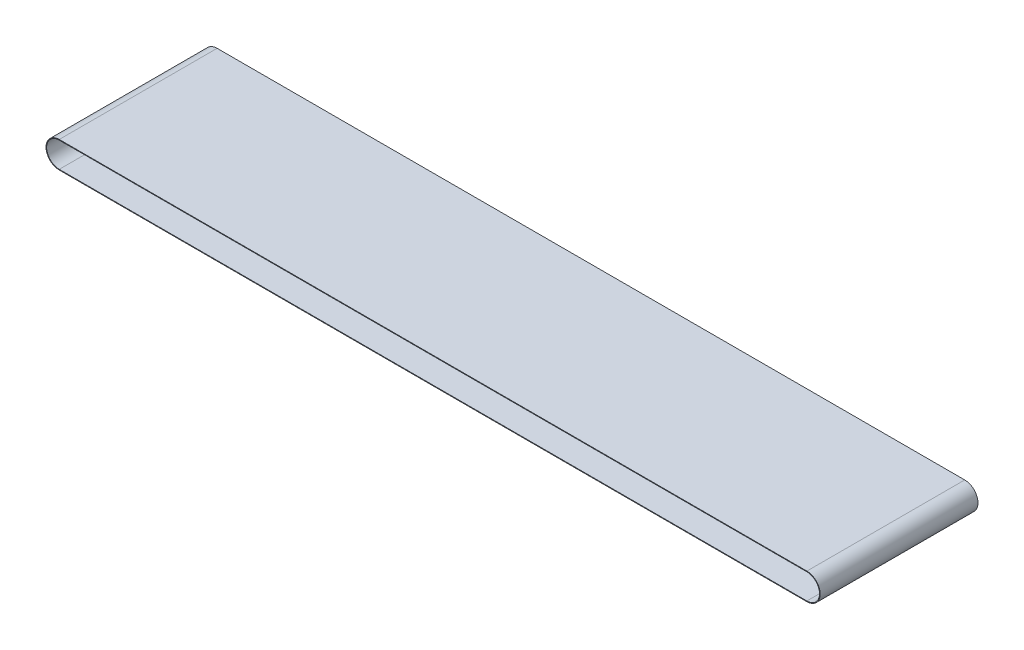
from build123d import *

# Parameters (mm, degrees)
ESTRUSIONE1_DEPTH = 250


with BuildPart() as part:
    # Schizzo1 → Estrusione1 (new, symmetric)
    with BuildSketch(Plane.XY):
        with BuildLine():
            Line((-1184.025, 42), (1184.025, 42))
            ThreePointArc((1184.025, 42), (1226.025, 0), (1184.025, -42))
            Line((1184.025, -42), (-1184.025, -42))
            ThreePointArc((-1184.025, -42), (-1226.025, 0), (-1184.025, 42))
        make_face()
        with BuildLine():
            Line((-1184.025, 40), (1184.025, 40))
            ThreePointArc((1184.025, 40), (1224.025, 0), (1184.025, -40))
            Line((1184.025, -40), (-1184.025, -40))
            ThreePointArc((-1184.025, -40), (-1224.025, 0), (-1184.025, 40))
        make_face(mode=Mode.SUBTRACT)
    extrude(amount=ESTRUSIONE1_DEPTH, both=True)


solid = part.part
